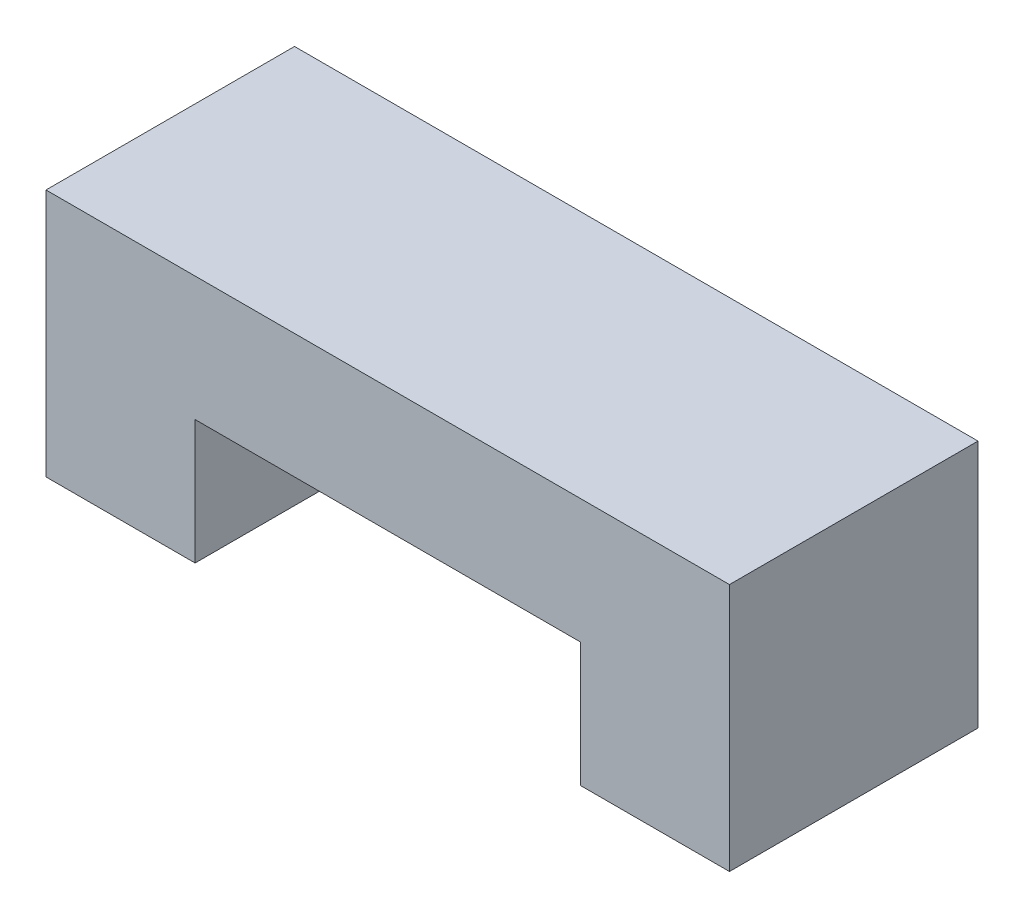
from build123d import *

# Parameters (mm, degrees)
BOSS_EXTRUDE1_DEPTH = 20


with BuildPart() as part:
    # Sketch1 → Boss-Extrude1 (new body)
    with BuildSketch(Plane.XY):
        Polygon((0, 0), (12, 0), (12, 10), (43, 10), (43, 0), (55, 0), (55, 20), (0, 20), align=None)
    extrude(amount=BOSS_EXTRUDE1_DEPTH)


solid = part.part
